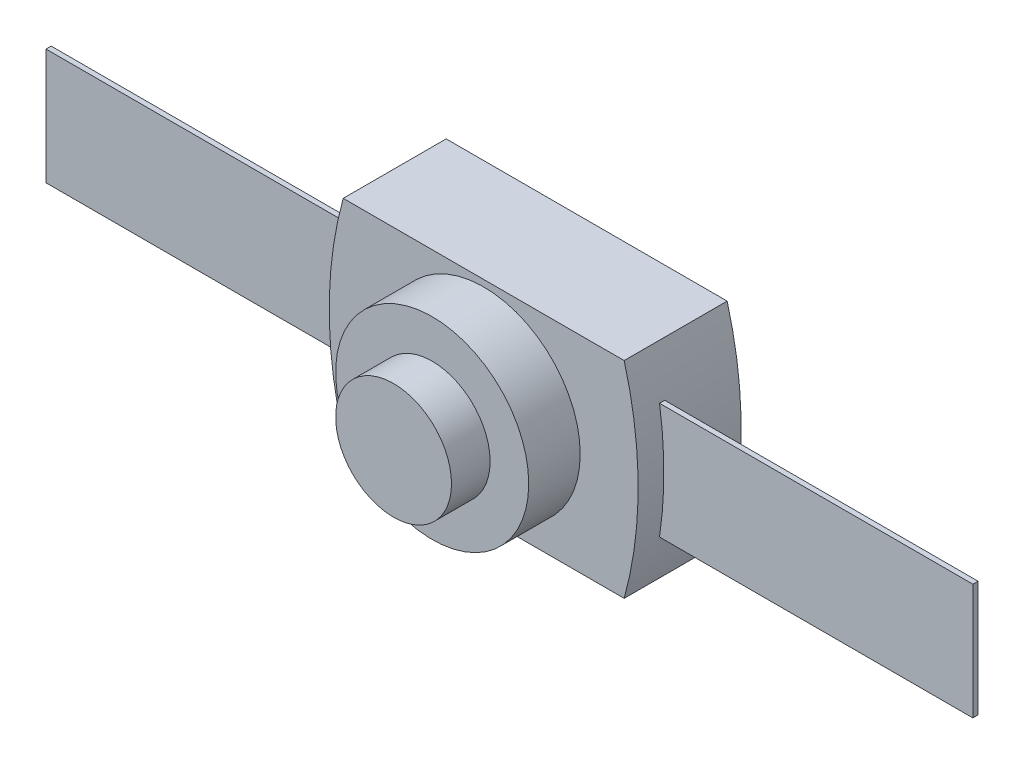
from build123d import *

# Parameters (mm, degrees)
EXTRUDE_1_DEPTH = 4
SKETCH_2_R      = 3.75
EXTRUDE_2_DEPTH = 2
SKETCH_3_R      = 2.25
EXTRUDE_3_DEPTH = 1.5
SKETCH_4_W      = 36
SKETCH_4_H      = 4.5
EXTRUDE_4_DEPTH = 0.2


with BuildPart() as part:
    # Эскиз1 → Бобышка-Вытянуть1 (new body)
    with BuildSketch(Plane.XY):
        with BuildLine():
            Line((11.456832295, 0), (6, 0))
            Line((6, 0), (6, -8))
            Line((6, -8), (11.456832295, -8))
            ThreePointArc((11.456832295, -8), (11.863587803, -6.01835518), (12, -3.999999921))
            ThreePointArc((12, -3.999999921), (11.863587792, -1.981644742), (11.456832295, 0))
        make_face()
        with BuildLine():
            Line((6, -8), (6, 0))
            Line((6, 0), (0.543167705, 0))
            ThreePointArc((0.543167705, 0), (0.136412203, -1.981644781), (0, -4))
            ThreePointArc((0, -4), (0.136412203, -6.018355219), (0.543167705, -8))
            Line((0.543167705, -8), (6, -8))
        make_face()
    extrude(amount=EXTRUDE_1_DEPTH)

    # Эскиз2 → Бобышка-Вытянуть2 (add)
    with BuildSketch(Plane.XY.offset(4)):
        with Locations((6, -4)):
            Circle(SKETCH_2_R)
    extrude(amount=EXTRUDE_2_DEPTH)

    # Эскиз3 → Бобышка-Вытянуть3 (add)
    with BuildSketch(Plane.XY.offset(6)):
        with Locations((6, -4)):
            Circle(SKETCH_3_R)
    extrude(amount=EXTRUDE_3_DEPTH)

    # Эскиз4 → Бобышка-Вытянуть4 (add)
    with BuildSketch(Plane(origin=(0, 0, 3), x_dir=(-1, 0, 0), z_dir=(0, 0, -1))):
        with Locations((-6, -4)):
            Rectangle(SKETCH_4_W, SKETCH_4_H)
    extrude(amount=EXTRUDE_4_DEPTH)


solid = part.part
